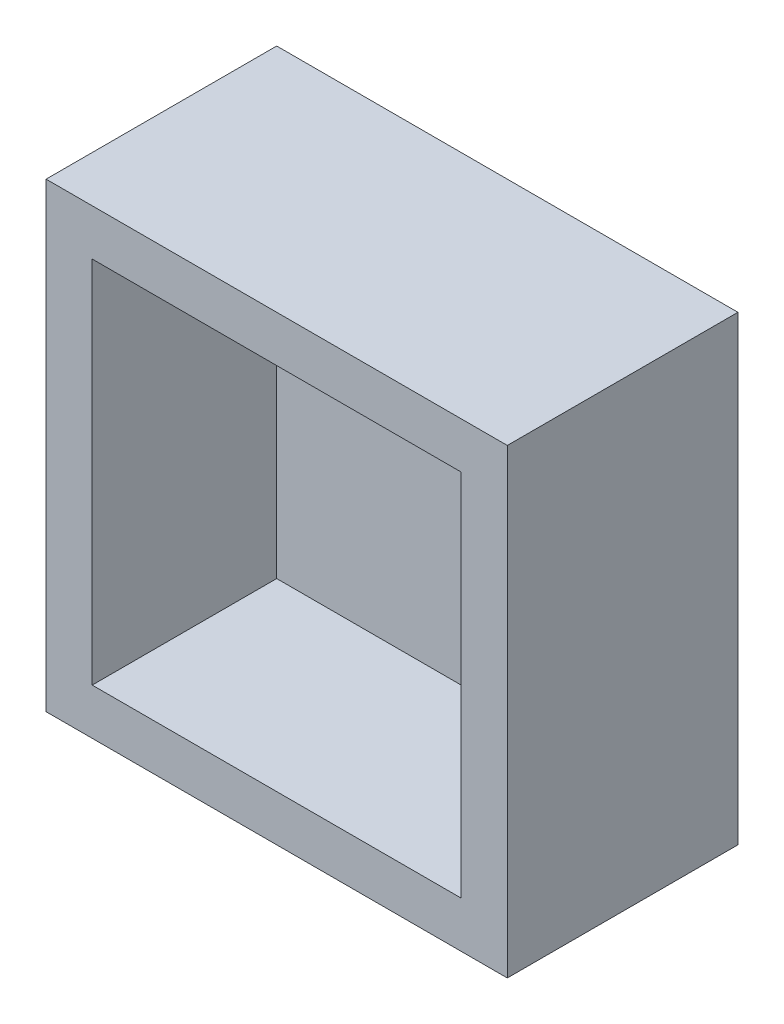
from build123d import *

# Parameters (mm, degrees)
SKETCH_1_W    = 20
SKETCH_1_H    = 20
BASEBOX_DEPTH = 10
SHELL_T       = -2


with BuildPart() as part:
    # 草图1 → BaseBox (new body)
    with BuildSketch(Plane.XY):
        with Locations((10, 10)):
            Rectangle(SKETCH_1_W, SKETCH_1_H)
    extrude(amount=BASEBOX_DEPTH)

    # Shell
    shell_openings = [part.faces().sort_by_distance(p)[0] for p in [
        (10, 10, 10),
    ]]
    offset(amount=SHELL_T, openings=shell_openings, kind=Kind.INTERSECTION)


solid = part.part
